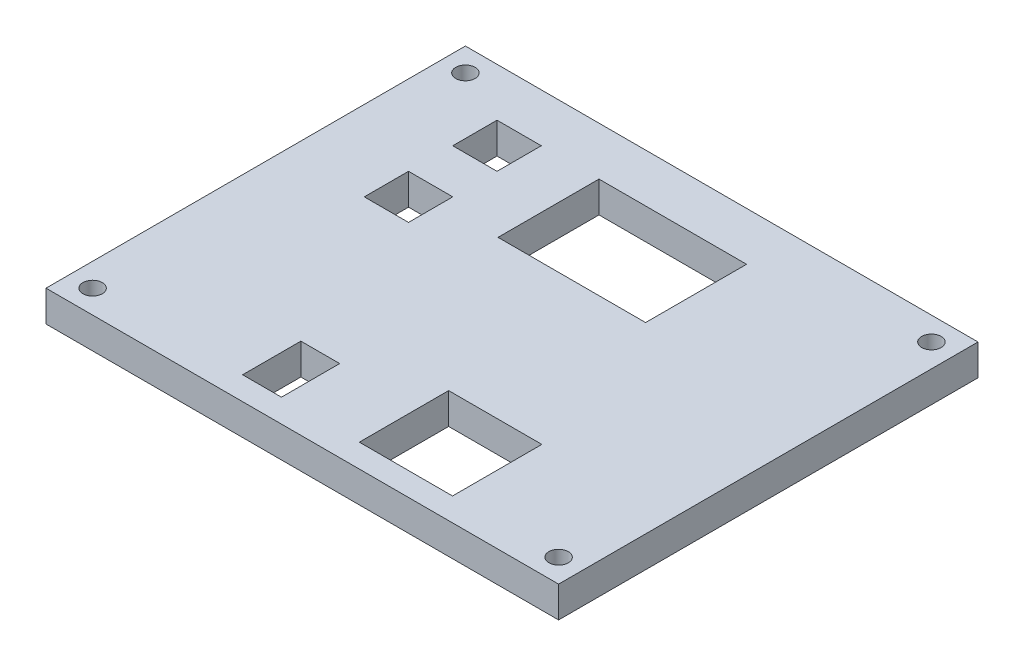
from build123d import *

# Parameters (mm, degrees)
SKETCH_2_W          = 66
SKETCH_2_H          = 54
EXTRUDE_1_DEPTH     = 4
HOLE_WIZARD_M3_1_D  = 2.5
SKETCH_7_W          = 5
SKETCH_7_H          = 7.5
SKETCH_7_W_2        = 5.7
SKETCH_7_H_2        = 5.7
SKETCH_7_W_3        = 19
SKETCH_7_H_3        = 13
SKETCH_7_W_4        = 12
SKETCH_7_H_4        = 11.5
CUT_EXTRUDE_1_DEPTH = 4


with BuildPart() as part:
    # 草图2 → 凸台-拉伸1 (new body)
    with BuildSketch(Plane(origin=(0, 0, 0), x_dir=(1, 0, 0), z_dir=(0, 1, 0))):
        with Locations((33, -27)):
            Rectangle(SKETCH_2_W, SKETCH_2_H)
    extrude(amount=EXTRUDE_1_DEPTH)

    # M3 螺纹孔1 (through all)
    with Locations(Plane(origin=(0, 4, 0), x_dir=(1, 0, 0), z_dir=(0, 1, 0))):
        with Locations((3, -3), (3, -51), (63, -51), (63, -3)):
            Hole(HOLE_WIZARD_M3_1_D / 2)

    # 草图7 → 切除-拉伸1 (cut)
    with BuildSketch(Plane(origin=(0, 4, 0), x_dir=(1, 0, 0), z_dir=(0, 1, 0))):
        with Locations((24.815080673, -47.25)):
            Rectangle(SKETCH_7_W, SKETCH_7_H)
        with Locations((13.157222246, -9.084625301)):
            Rectangle(SKETCH_7_W_2, SKETCH_7_H_2)
        with Locations((13.157222246, -20.480710499)):
            Rectangle(SKETCH_7_W_2, SKETCH_7_H_2)
        with Locations((32.935955056, -12.734625301)):
            Rectangle(SKETCH_7_W_3, SKETCH_7_H_3)
        with Locations((43.342846772, -45.25)):
            Rectangle(SKETCH_7_W_4, SKETCH_7_H_4)
    extrude(amount=-CUT_EXTRUDE_1_DEPTH, mode=Mode.SUBTRACT)


solid = part.part
